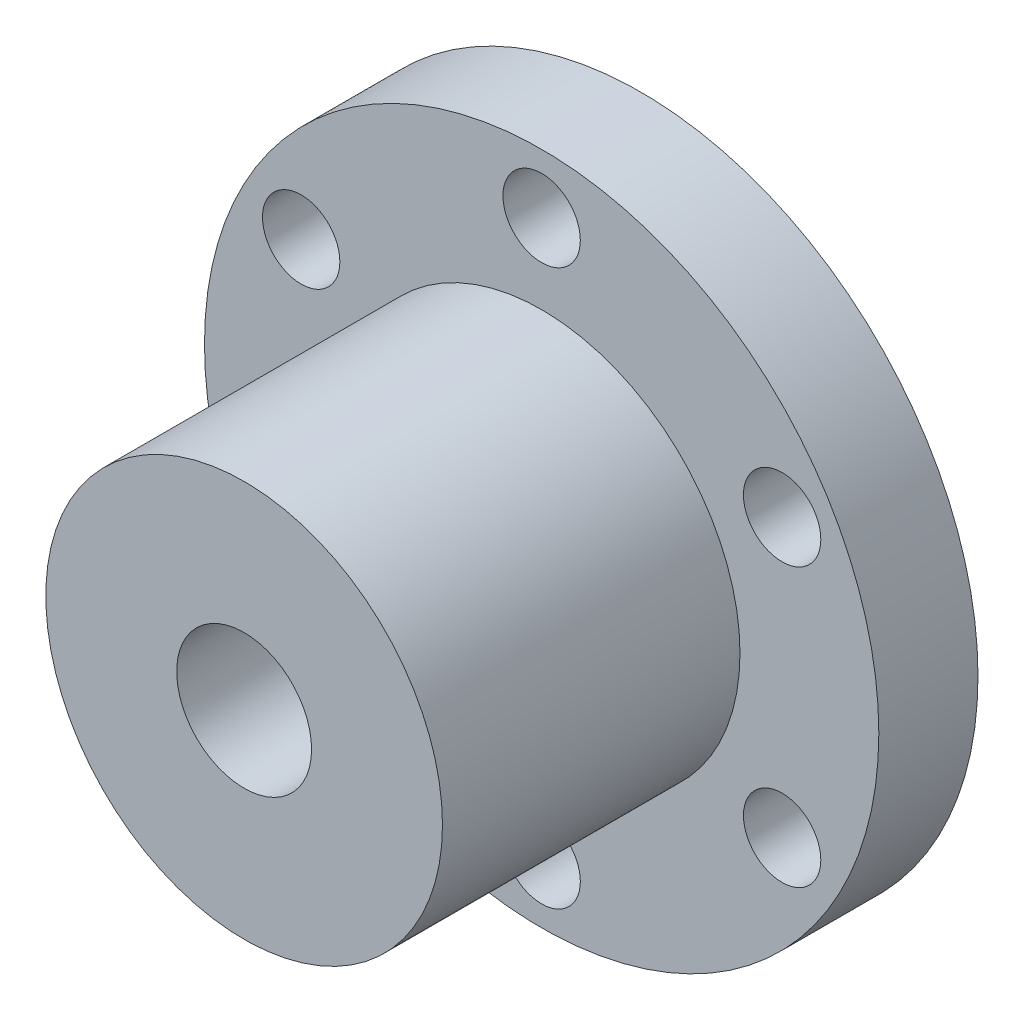
from build123d import *

# Parameters (mm, degrees)
TALADRO_ROSCADO_M81_D     = 6.8
TALADRO_ROSCADO_M81_DEPTH = 22.25
TALADRO_ROSCADO_M81_TIP   = 2.042926105
MATRIZC1_COUNT            = 6


with BuildPart() as part:
    # Croquis1 → Revolución1 (revolve)
    with BuildSketch(Plane(origin=(0, 0, 0), x_dir=(1, 0, 0), z_dir=(0, 1, 0))):
        Polygon((0, 0), (17, 0), (17, -5), (10, -5), (10, -20), (0, -20), align=None)
    revolve(axis=Axis((0, 0, 0), (0, 0, -1)))

    # Taladro roscado M81
    with Locations(Plane.XY.offset(20)):
        with Locations((0, 0)):
            Hole(TALADRO_ROSCADO_M81_D / 2, depth=TALADRO_ROSCADO_M81_DEPTH)
            with Locations((0, 0, -(TALADRO_ROSCADO_M81_DEPTH + TALADRO_ROSCADO_M81_TIP / 2))):  # 118° drill point
                Cone(0, TALADRO_ROSCADO_M81_D / 2, TALADRO_ROSCADO_M81_TIP, mode=Mode.SUBTRACT)

    # Croquis4 → Taladro de margen para M3.51 (revolve, cut)
    with BuildSketch(Plane(origin=(0, 14, 0), x_dir=(0, 1, 0), z_dir=(1, 0, 0))):
        Polygon((0, 0), (0, 501.171678207), (1.95, 500), (1.95, 0), align=None)
    taladro_de_margen_para_m3_51 = revolve(axis=Axis((0, 14, -6.35), (0, 0, 1)), mode=Mode.SUBTRACT)

    # MatrizC1: Taladro de margen para M3.51 ×6 about axis
    matrizc1_axis = Axis((0, 0, 0), (0, 0, 1))
    for i in range(1, MATRIZC1_COUNT):
        add(taladro_de_margen_para_m3_51.rotate(matrizc1_axis, i * 360 / MATRIZC1_COUNT), mode=Mode.SUBTRACT)


solid = part.part
